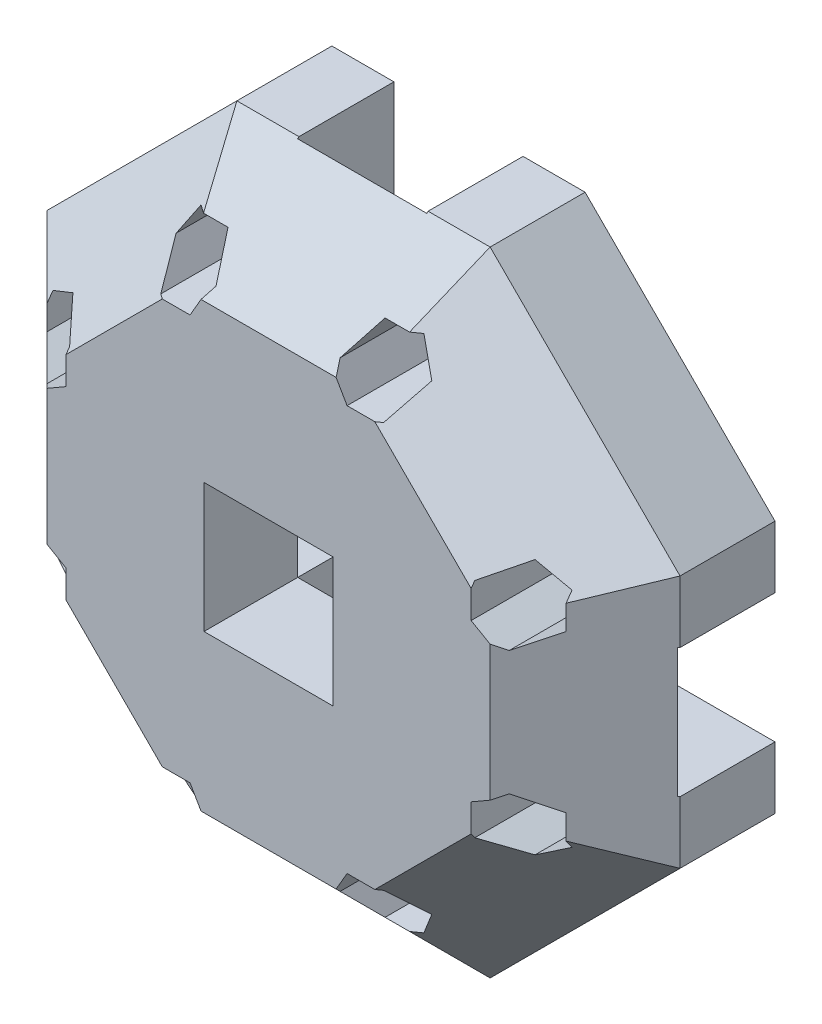
from build123d import *

# Parameters (mm, degrees)
EXTRUDE_1_DEPTH          = 30
CHAMFER_1_SIZE           = 15
SKETCH_2_W               = 15.2
SKETCH_2_H               = 20.4
CUT_EXTRUDE_1_DEPTH      = 50
SKETCH_3_R               = 2.55
CUT_EXTRUDE_2_DEPTH      = 77.811457479
CUT_EXTRUDE_3_DEPTH      = 15
PATTERN_CIRCULAR_1_COUNT = 4
SKETCH_6_W               = 20.4
SKETCH_6_H               = 20.4
CUT_EXTRUDE_4_DEPTH      = 73.325928961


with BuildPart() as part:
    # 스케치1 → 보스-돌출1 (new body)
    with BuildSketch(Plane.XY):
        Polygon((-20, 50), (-50, 20), (-50, -20), (-20, -50), (20, -50), (50, -20), (50, 20), (20, 50), align=None)
    extrude(amount=EXTRUDE_1_DEPTH)

    # 모따기1
    chamfer_1_edges = [part.edges().sort_by_distance(p)[0] for p in [
        (-50, 0, 30),
        (-35, -35, 30),
        (0, -50, 30),
        (35, -35, 30),
        (50, 0, 30),
        (35, 35, 30),
        (0, 50, 30),
        (-35, 35, 30),
    ]]
    chamfer(chamfer_1_edges, length=CHAMFER_1_SIZE)

    # 스케치2 → 컷-돌출1 (cut)
    with BuildSketch(Plane(origin=(50, 0, 0), x_dir=(0, 0, -1), z_dir=(1, 0, 0))):
        with Locations((-7.6, 0)):
            Rectangle(SKETCH_2_W, SKETCH_2_H)
    cut_extrude_1 = extrude(amount=-CUT_EXTRUDE_1_DEPTH, mode=Mode.SUBTRACT)

    # 스케치3 → 컷-돌출2 (cut, through all)
    with BuildSketch(Plane.XY.offset(30)):
        with Locations((36.5, -15)):
            Circle(SKETCH_3_R)
        with Locations((36.5, 15)):
            Circle(SKETCH_3_R)
        with Locations((-15, -36.5)):
            Circle(SKETCH_3_R)
        with Locations((15, -36.5)):
            Circle(SKETCH_3_R)
        with Locations((-36.5, 15)):
            Circle(SKETCH_3_R)
        with Locations((-36.5, -15)):
            Circle(SKETCH_3_R)
        with Locations((15, 36.5)):
            Circle(SKETCH_3_R)
        with Locations((-15, 36.5)):
            Circle(SKETCH_3_R)
    extrude(amount=-CUT_EXTRUDE_2_DEPTH, mode=Mode.SUBTRACT)

    # 스케치4 → 컷-돌출3 (cut)
    with BuildSketch(Plane.XY.offset(30)):
        Polygon((-12.401923789, -32), (-17.598076211, -32), (-20.196152423, -36.5), (-17.598076211, -41), (-12.401923789, -41), (-9.803847577, -36.5), align=None)
        Polygon((32, -12.401923789), (32, -17.598076211), (36.5, -20.196152423), (41, -17.598076211), (41, -12.401923789), (36.5, -9.803847577), align=None)
        Polygon((36.5, 9.803847577), (41, 12.401923789), (41, 17.598076211), (36.5, 20.196152423), (32, 17.598076211), (32, 12.401923789), align=None)
        Polygon((9.803847577, -36.5), (12.401923789, -41), (17.598076211, -41), (20.196152423, -36.5), (17.598076211, -32), (12.401923789, -32), align=None)
        Polygon((-32, 12.401923789), (-32, 17.598076211), (-36.5, 20.196152423), (-41, 17.598076211), (-41, 12.401923789), (-36.5, 9.803847577), align=None)
        Polygon((-36.5, -9.803847577), (-41, -12.401923789), (-41, -17.598076211), (-36.5, -20.196152423), (-32, -17.598076211), (-32, -12.401923789), align=None)
        Polygon((12.401923789, 32), (17.598076211, 32), (20.196152423, 36.5), (17.598076211, 41), (12.401923789, 41), (9.803847577, 36.5), align=None)
        Polygon((-9.803847577, 36.5), (-12.401923789, 41), (-17.598076211, 41), (-20.196152423, 36.5), (-17.598076211, 32), (-12.401923789, 32), align=None)
    extrude(amount=-CUT_EXTRUDE_3_DEPTH, mode=Mode.SUBTRACT)

    # 원형 패턴1: 컷-돌출1 ×4 about axis
    pattern_circular_1_axis = Axis((0, 0, 0), (0, 0, 1))
    for i in range(1, PATTERN_CIRCULAR_1_COUNT):
        add(cut_extrude_1.rotate(pattern_circular_1_axis, i * 360 / PATTERN_CIRCULAR_1_COUNT), mode=Mode.SUBTRACT)

    # 스케치6 → 컷-돌출4 (cut, through all)
    with BuildSketch(Plane(origin=(0, 0, 15.2), x_dir=(-1, 0, 0), z_dir=(0, 0, -1))):
        Rectangle(SKETCH_6_W, SKETCH_6_H)
    extrude(amount=-CUT_EXTRUDE_4_DEPTH, mode=Mode.SUBTRACT)


solid = part.part
